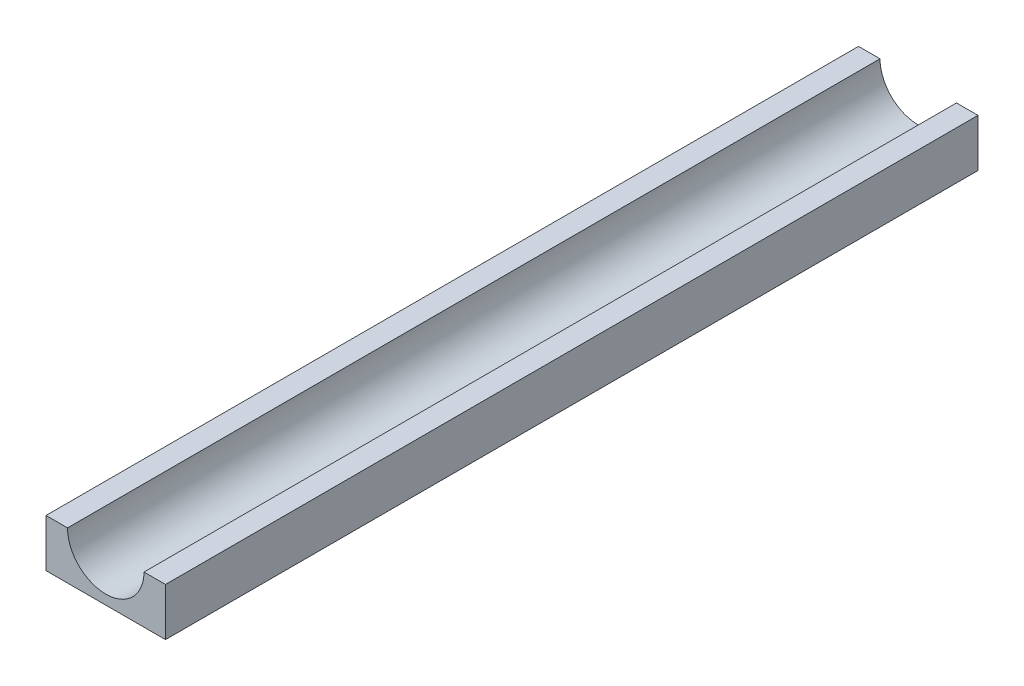
from build123d import *

# Parameters (mm, degrees)
SKETCH2_W           = 25
SKETCH2_H           = 10
BOSS_EXTRUDE1_DEPTH = 170
CUT_EXTRUDE1_DEPTH  = 170


with BuildPart() as part:
    # Sketch2 → Boss-Extrude1 (new body)
    with BuildSketch(Plane.XY):
        Rectangle(SKETCH2_W, SKETCH2_H)
    extrude(amount=BOSS_EXTRUDE1_DEPTH)

    # Sketch3 → Cut-Extrude1 (cut)
    with BuildSketch(Plane(origin=(0, 0, 0), x_dir=(-1, 0, 0), z_dir=(0, 0, -1))):
        with BuildLine():
            Line((-8, 5), (8, 5))
            ThreePointArc((8, 5), (0, -3), (-8, 5))
        make_face()
    extrude(amount=-CUT_EXTRUDE1_DEPTH, mode=Mode.SUBTRACT)


solid = part.part
